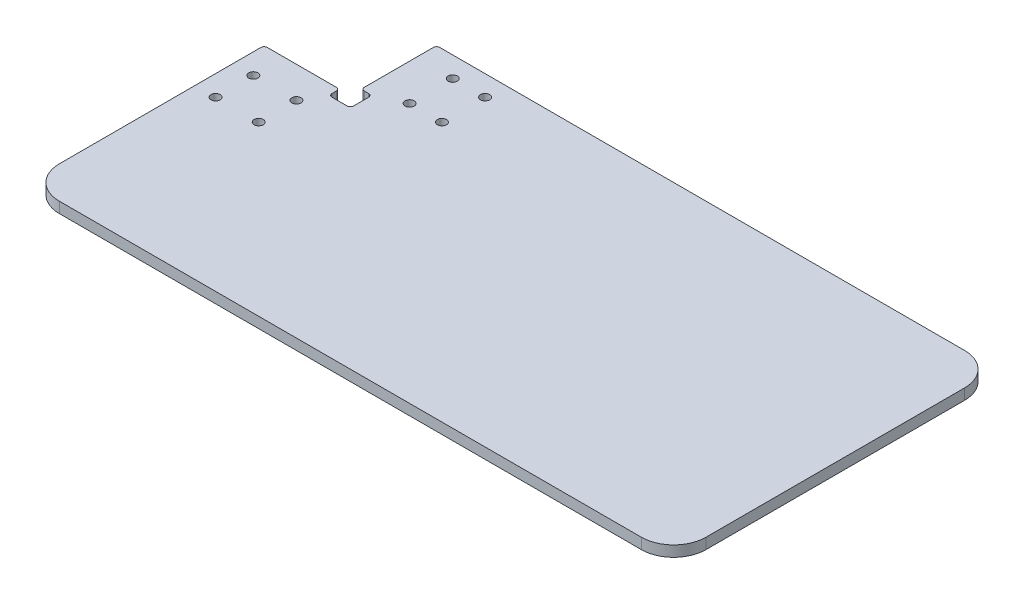
from build123d import *

# Parameters (mm, degrees)
SKETCH_1_R      = 4.25
EXTRUDE_1_DEPTH = 10
FILLET_1_R      = 30
FILLET_2_R      = 3


with BuildPart() as part:
    # 草图1 → 凸台-拉伸1 (new body)
    with BuildSketch(Plane(origin=(0, 0, 0), x_dir=(1, 0, 0), z_dir=(0, 1, 0))):
        Polygon((80, 0), (80, -70), (90, -70), (90, -90), (70, -90), (70, -80), (0, -80), (0, -300), (600, -300), (600, 0), align=None)
        with Locations(Location((144, -19, 0), (0, 0, 270))):
            Circle(SKETCH_1_R, mode=Mode.SUBTRACT)
        with Locations(Location((114, -19, 0), (0, 0, 270))):
            Circle(SKETCH_1_R, mode=Mode.SUBTRACT)
        with Locations(Location((144, -59, 0), (0, 0, 270))):
            Circle(SKETCH_1_R, mode=Mode.SUBTRACT)
        with Locations(Location((114, -59, 0), (0, 0, 270))):
            Circle(SKETCH_1_R, mode=Mode.SUBTRACT)
        with Locations(Location((19, -109, 0), (0, 0, 270))):
            Circle(SKETCH_1_R, mode=Mode.SUBTRACT)
        with Locations(Location((59, -109, 0), (0, 0, 270))):
            Circle(SKETCH_1_R, mode=Mode.SUBTRACT)
        with Locations(Location((19, -144, 0), (0, 0, 270))):
            Circle(SKETCH_1_R, mode=Mode.SUBTRACT)
        with Locations(Location((59, -144, 0), (0, 0, 270))):
            Circle(SKETCH_1_R, mode=Mode.SUBTRACT)
    extrude(amount=EXTRUDE_1_DEPTH)

    # 圆角1
    fillet_1_edges = [part.edges().sort_by_distance(p)[0] for p in [
        (600, 5, 300),
        (0, 5, 300),
        (600, 5, 0),
    ]]
    fillet(fillet_1_edges, radius=FILLET_1_R)

    # 圆角2
    fillet_2_edges = [part.edges().sort_by_distance(p)[0] for p in [
        (0, 5, 80),
        (70, 5, 80),
        (70, 5, 90),
        (90, 5, 90),
        (90, 5, 70),
        (80, 5, 70),
        (80, 5, 0),
    ]]
    fillet(fillet_2_edges, radius=FILLET_2_R)


solid = part.part
